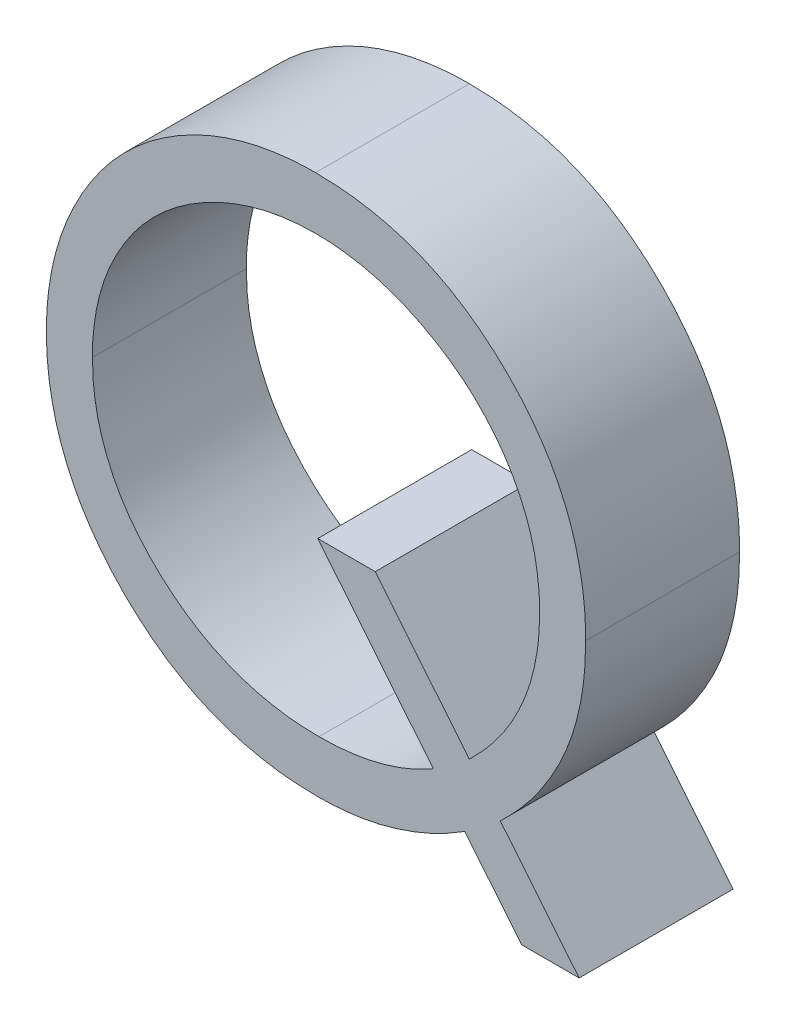
from build123d import *

# Parameters (mm, degrees)
BOSS_EXTRU_1_DEPTH = 1.5


with BuildPart() as part:
    # Esquisse1 → Boss.-Extru.1 (new body)
    with BuildSketch(Plane.XY):
        with BuildLine():
            Line((-51.264797057, -22.313228051), (-50.49656789, -23.254734461))
            Line((-50.49656789, -23.254734461), (-51.056463723, -23.254734461))
            Line((-51.056463723, -23.254734461), (-51.611351544, -22.575647922))
            add(Edge.make_bspline(
                [(-51.611351544, -22.575647922), (-51.667004534, -22.609467545), (-51.77728534, -22.676483804), (-51.949237679, -22.762864043), (-52.124609537, -22.834743668), (-52.303012884, -22.894129346), (-52.484187867, -22.941664096), (-52.669053208, -22.974655224), (-52.856938413, -22.99381276), (-52.983170416, -22.996814657), (-53.046648018, -22.998324204)],
                knots=[0, 0, 0, 0, 1.030216282, 2.041455142, 3.041201647, 4.026904037, 5.014869161, 6.002481075, 6.995518502, 8, 8, 8, 8], degree=3))
            add(Edge.make_bspline(
                [(-53.046648018, -22.998324204), (-53.137591362, -22.99613371), (-53.316540791, -22.991823468), (-53.579355244, -22.954194244), (-53.831617557, -22.896079216), (-54.072824915, -22.811992553), (-54.303240075, -22.704589006), (-54.522755987, -22.572175755), (-54.731484222, -22.416586876), (-54.926343637, -22.238839192), (-55.104522805, -22.045474469), (-55.26086386, -21.838872985), (-55.393795998, -21.622463043), (-55.50127955, -21.395165474), (-55.586582113, -21.158959064), (-55.644713497, -20.911879357), (-55.682341265, -20.655397184), (-55.686676076, -20.480764083), (-55.688875582, -20.392154333)],
                knots=[0, 0, 0, 0, 1.055750571, 2.07740284, 3.077223765, 4.05828044, 5.038417088, 6.02463293, 7.030503776, 8.057169806, 9.083586829, 10.080154041, 11.061747002, 12.027853603, 12.995569715, 13.972756451, 14.971366004, 16, 16, 16, 16], degree=3))
            add(Edge.make_bspline(
                [(-55.688875582, -20.392154333), (-55.688093022, -20.33268107), (-55.686533398, -20.214152396), (-55.668491753, -20.038599293), (-55.641686338, -19.865936249), (-55.603771119, -19.696880782), (-55.554136935, -19.530739956), (-55.494630673, -19.367841379), (-55.422530915, -19.208604795), (-55.341023889, -19.053356113), (-55.250120175, -18.903440884), (-55.151096695, -18.7609928), (-55.043709844, -18.627415695), (-54.928035643, -18.502770687), (-54.804536059, -18.386782246), (-54.674273088, -18.277540391), (-54.534469264, -18.179109035), (-54.388814443, -18.087571822), (-54.236491808, -18.007077518), (-54.080480787, -17.935118183), (-53.919614333, -17.87673225), (-53.755979702, -17.826980362), (-53.588584139, -17.788997635), (-53.417558106, -17.762388722), (-53.243021921, -17.744173055), (-53.125153863, -17.742671581), (-53.065678467, -17.741913948)],
                knots=[0, 0, 0, 0, 1.030721839, 2.054201982, 3.056261636, 4.058906239, 5.055198403, 6.060579377, 7.06322398, 8.083343201, 9.098870418, 10.10084648, 11.0888991, 12.067804703, 13.046436456, 14.024708667, 15.012489976, 16.008294399, 17.005242112, 17.997338632, 18.984424362, 19.969624474, 20.960977749, 21.957320355, 22.969278161, 24, 24, 24, 24], degree=3))
            add(Edge.make_bspline(
                [(-53.065678467, -17.741913948), (-52.974734783, -17.744093445), (-52.796115568, -17.748374118), (-52.533952193, -17.786009017), (-52.282433034, -17.844357249), (-52.041737142, -17.928015386), (-51.812079117, -18.035689413), (-51.593555443, -18.168075975), (-51.385827324, -18.32367516), (-51.191986113, -18.501434748), (-51.014226591, -18.69527595), (-50.85862716, -18.903004041), (-50.726241492, -19.121527831), (-50.61856416, -19.35118542), (-50.534918456, -19.591882956), (-50.476447848, -19.843718418), (-50.438992649, -20.106242587), (-50.434664779, -20.285187594), (-50.432465326, -20.376128692)],
                knots=[0, 0, 0, 0, 1.050672203, 2.063587442, 3.054842799, 4.031180399, 5.003107577, 5.981273811, 6.979214548, 7.998088659, 9.016962771, 10.014903508, 10.993069742, 11.96499692, 12.941334519, 13.932589877, 14.949327797, 16, 16, 16, 16], degree=3))
            add(Edge.make_bspline(
                [(-50.432465326, -20.376128692), (-50.434869066, -20.4707535), (-50.439595885, -20.65682783), (-50.479821925, -20.929686009), (-50.544498334, -21.190329847), (-50.636217294, -21.438588569), (-50.754789182, -21.67441705), (-50.897923277, -21.9001736), (-51.067342928, -22.115842211), (-51.198285863, -22.24673986), (-51.264797057, -22.313228051)],
                knots=[0, 0, 0, 0, 1.045660934, 2.056233022, 3.041853582, 4.009978652, 4.97562384, 5.954545411, 6.961031197, 8, 8, 8, 8], degree=3))
        make_face()
        with BuildLine():
            add(Edge.make_bspline(
                [(-51.566279428, -21.943636704), (-51.51172417, -21.888232457), (-51.404411558, -21.779249846), (-51.265175554, -21.600524131), (-51.145418622, -21.41474237), (-51.049540161, -21.219433228), (-50.973255773, -21.017043638), (-50.92055164, -20.805969946), (-50.887551523, -20.587173057), (-50.883321632, -20.438345407), (-50.881183275, -20.363107858)],
                knots=[0, 0, 0, 0, 1.052210109, 2.069743939, 3.061837814, 4.040478349, 5.010453814, 5.985306305, 6.981502329, 8, 8, 8, 8], degree=3))
            add(Edge.make_bspline(
                [(-50.881183275, -20.363107858), (-50.881741995, -20.314655812), (-50.882846488, -20.218874654), (-50.898033237, -20.077135344), (-50.91951797, -19.93852653), (-50.950621278, -19.80329587), (-50.990674696, -19.671717346), (-51.040144187, -19.543969579), (-51.098065914, -19.419640443), (-51.165589992, -19.299502266), (-51.240029574, -19.183729173), (-51.322889962, -19.073737016), (-51.413004847, -18.970092944), (-51.509389767, -18.871088951), (-51.613903021, -18.778765875), (-51.726169785, -18.693163291), (-51.844806679, -18.61220964), (-51.970400768, -18.539138521), (-52.099825438, -18.471961029), (-52.232323378, -18.413789478), (-52.366782042, -18.364520258), (-52.502993214, -18.324569248), (-52.640780636, -18.293122716), (-52.780385877, -18.271662023), (-52.921447917, -18.256490913), (-53.016225731, -18.255320444), (-53.063675262, -18.254734461)],
                knots=[0, 0, 0, 0, 1.032958288, 2.041976502, 3.037103433, 4.023477888, 4.998866292, 5.968231228, 6.943073582, 7.921783703, 8.90545537, 9.876780072, 10.85618943, 11.833110341, 12.821898168, 13.827467856, 14.842673888, 15.88323808, 16.924703457, 17.951432745, 18.967462636, 19.976958182, 20.977218729, 21.979378626, 22.98839684, 24, 24, 24, 24], degree=3))
            add(Edge.make_bspline(
                [(-53.063675262, -18.254734461), (-53.111457778, -18.255324533), (-53.206900075, -18.256503161), (-53.348643141, -18.271578114), (-53.488568776, -18.293146341), (-53.626061561, -18.32443658), (-53.761608406, -18.364465284), (-53.894788585, -18.414032363), (-54.0267603, -18.470767101), (-54.154785018, -18.5379017), (-54.278638739, -18.61160116), (-54.396431464, -18.691749867), (-54.506548929, -18.779147467), (-54.610035703, -18.872386866), (-54.706633311, -18.972187476), (-54.796797838, -19.07788543), (-54.878945838, -19.190707144), (-54.954208859, -19.30863406), (-55.020729887, -19.431794307), (-55.080723414, -19.557965778), (-55.129451484, -19.688539497), (-55.169456196, -19.822470357), (-55.202146101, -19.959425394), (-55.223216014, -20.100199627), (-55.23851668, -20.243914258), (-55.239606438, -20.341030193), (-55.240157634, -20.390151128)],
                knots=[0, 0, 0, 0, 1.013205451, 2.023808328, 3.020541854, 4.015386314, 5.012622987, 6.016502547, 7.02834558, 8.057881235, 9.080621846, 10.084476421, 11.077781791, 12.060654405, 13.037357686, 14.022218736, 15.005346502, 15.995617173, 16.98763393, 17.973029642, 18.956998942, 19.940662314, 20.93709383, 21.940823471, 22.958474994, 24, 24, 24, 24], degree=3))
            add(Edge.make_bspline(
                [(-55.240157634, -20.390151128), (-55.238281124, -20.462369572), (-55.23458945, -20.604445595), (-55.203986388, -20.813037716), (-55.152676513, -21.012732702), (-55.080891868, -21.20381624), (-54.990776092, -21.3873897), (-54.87871031, -21.561654676), (-54.745172628, -21.725947416), (-54.595214832, -21.881396386), (-54.430259018, -22.022226929), (-54.255389856, -22.146173183), (-54.072100339, -22.251330598), (-53.879814905, -22.3362049), (-53.679967434, -22.404361837), (-53.470980336, -22.450505446), (-53.254219766, -22.48109067), (-53.106517754, -22.484018902), (-53.03162398, -22.485503692)],
                knots=[0, 0, 0, 0, 1.022526523, 2.011626, 2.97850031, 3.937665323, 4.897797383, 5.869804095, 6.865337375, 7.89202157, 8.925035373, 9.93268082, 10.923937058, 11.912550332, 12.905497077, 13.90928476, 14.939882052, 16, 16, 16, 16], degree=3))
            add(Edge.make_bspline(
                [(-53.03162398, -22.485503692), (-52.980169117, -22.484943162), (-52.878395032, -22.483834474), (-52.728317882, -22.468719305), (-52.581913274, -22.447444392), (-52.440536952, -22.415087335), (-52.302962964, -22.374860395), (-52.170010193, -22.325927955), (-52.040973375, -22.267918136), (-51.958926133, -22.222025542), (-51.917841928, -22.199045358)],
                knots=[0, 0, 0, 0, 1.060694673, 2.097979151, 3.107774411, 4.11000626, 5.086069662, 6.061987343, 7.029562652, 8, 8, 8, 8], degree=3))
            Line((-51.917841928, -22.199045358), (-53.04364321, -20.818837025))
            Line((-53.04364321, -20.818837025), (-52.483747377, -20.818837025))
            Line((-52.483747377, -20.818837025), (-51.566279428, -21.943636704))
        make_face(mode=Mode.SUBTRACT)
    extrude(amount=BOSS_EXTRU_1_DEPTH)


solid = part.part
